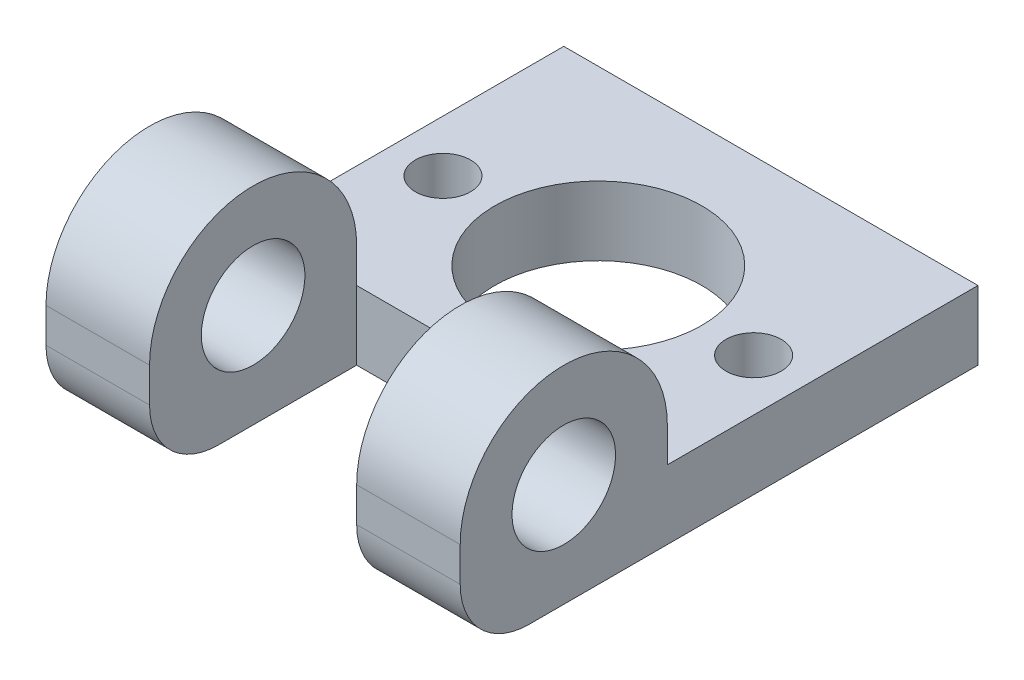
from build123d import *
from build123d.topology import SkipClean

# Parameters (mm, degrees)
SKETCH_1_W               = 12
SKETCH_1_H               = 15
SKETCH_1_R               = 0.8
SKETCH_1_R_2             = 3
EXTRUDE_1_DEPTH          = 2
EXTRUDE_3_DEPTH          = 12
CUT_EXTRUDE_1_REACH      = 17.37
SKETCH_2_3_R             = 1.5
CUT_EXTRUDE_2_DEPTH      = 3
CUT_EXTRUDE_2_DEPTH_BACK = 3
FILLET_1_R               = 2


with BuildPart() as part:
    # 草图1 → 凸台-拉伸1 (new body)
    with BuildSketch(Plane(origin=(0, 0, 0), x_dir=(1, 0, 0), z_dir=(0, 1, 0))):
        Rectangle(SKETCH_1_W, SKETCH_1_H)
        with Locations(Location((-4.5, 2.5, 0), (0, 0, 270))):
            Circle(SKETCH_1_R, mode=Mode.SUBTRACT)
        with Locations(Location((4.5, 2.5, 0), (0, 0, 270))):
            Circle(SKETCH_1_R, mode=Mode.SUBTRACT)
        with Locations(Location((0, 2.5, 0), (0, 0, 270))):
            Circle(SKETCH_1_R_2, mode=Mode.SUBTRACT)
    extrude(amount=EXTRUDE_1_DEPTH)

    # 草图2 → 凸台-拉伸3 (add)
    with BuildSketch(Plane.ZY.offset(6)):
        with BuildLine():
            ThreePointArc((7.5, 3), (4.5, 6), (1.5, 3))
            Line((1.5, 3), (1.5, 2))
            Line((1.5, 2), (3.381966011, 2))
            ThreePointArc((3.381966011, 2), (3.964766865, 4.401258538), (6, 3))
            ThreePointArc((6, 3), (5.901258538, 2.464766865), (5.618033989, 2))
            Line((5.618033989, 2), (7.5, 2))
            Line((7.5, 2), (7.5, 3))
        make_face()
    extrude(amount=-EXTRUDE_3_DEPTH)

    # 草图2<3> → 切除-拉伸1 (cut, up to next)
    with BuildSketch(Plane.ZY.offset(6), mode=Mode.PRIVATE) as cut_extrude_1_sk1:
        with Locations((4.5, 3)):
            Circle(SKETCH_2_3_R)
    cut_extrude_1_tool1 = extrude(cut_extrude_1_sk1.sketch, amount=-CUT_EXTRUDE_1_REACH, mode=Mode.PRIVATE) & part.part
    add(cut_extrude_1_tool1.solids().sort_by_distance((-6, 3, 4.5))[0], mode=Mode.SUBTRACT)

    # 草图5 → 切除-拉伸2 (cut, two sides: drawn at the far end of the back side and taken through both)
    with SkipClean():  # the faces are left unmerged after this step: merging them gives an invalid solid
        with BuildSketch(Plane.ZY.offset(-CUT_EXTRUDE_2_DEPTH_BACK)):
            with BuildLine():
                Line((1.5, 2), (1.5, 0))
                Line((1.5, 0), (7.5, 0))
                Line((7.5, 0), (7.5, 3))
                ThreePointArc((7.5, 3), (4.5, 6), (1.5, 3))
                Line((1.5, 3), (1.5, 2))
            make_face()
        extrude(amount=CUT_EXTRUDE_2_DEPTH + CUT_EXTRUDE_2_DEPTH_BACK, mode=Mode.SUBTRACT)

    # 圆角1
    fillet_1_edges = [part.edges().sort_by_distance(p)[0] for p in [
        (-4.5, 0, 7.5),
        (4.5, 0, 7.5),
    ]]
    fillet(fillet_1_edges, radius=FILLET_1_R)


solid = part.part
